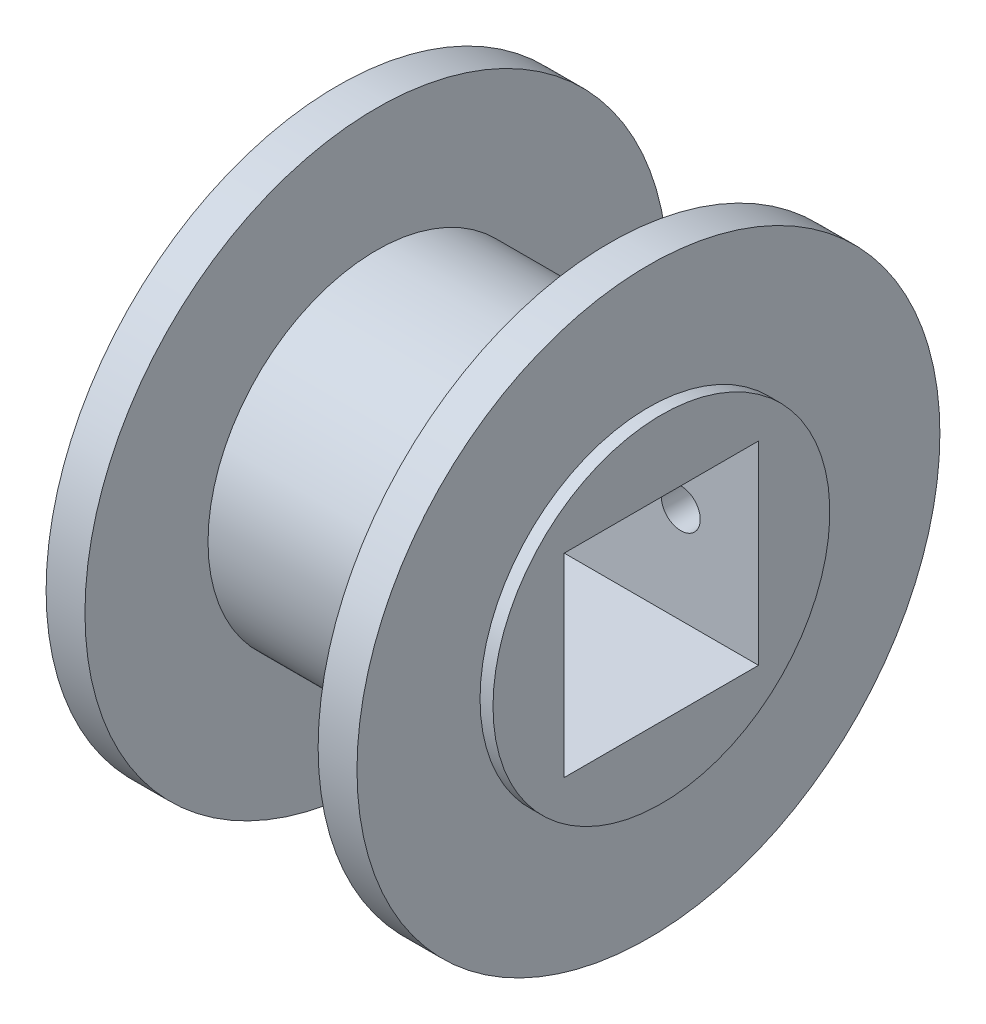
from build123d import *

# Parameters (mm, degrees)
SKETCH2_W          = 15
SKETCH2_H          = 15
CUT_EXTRUDE1_DEPTH = 42.091361623
SKETCH3_R          = 1.5
CUT_EXTRUDE2_DEPTH = 35.372954485


with BuildPart() as part:
    # Sketch1 → Revolve1 (revolve)
    with BuildSketch(Plane.XY, mode=Mode.PRIVATE) as revolve1_sk:
        Polygon((-13, 7.5), (13, 7.5), (13, 13), (12, 13), (12, 22.5), (9, 22.5), (9, 13), (-9, 13), (-9, 22.5), (-12, 22.5), (-12, 13), (-13, 13), align=None)
    revolve(revolve1_sk.sketch.rotate(Axis((0, 0, 0), (1, 0, 0)), 90), axis=Axis((0, 0, 0), (1, 0, 0)))

    # Sketch2 → Cut-Extrude1 (cut, through all)
    with BuildSketch(Plane(origin=(13, 0, 0), x_dir=(0, 0, -1), z_dir=(1, 0, 0))):
        Rectangle(SKETCH2_W, SKETCH2_H)
    extrude(amount=-CUT_EXTRUDE1_DEPTH, mode=Mode.SUBTRACT)

    # Sketch3 → Cut-Extrude2 (cut, through all)
    with BuildSketch(Plane.XY):
        with Locations((7, 0)):
            Circle(SKETCH3_R)
    extrude(amount=-CUT_EXTRUDE2_DEPTH, mode=Mode.SUBTRACT)


solid = part.part
